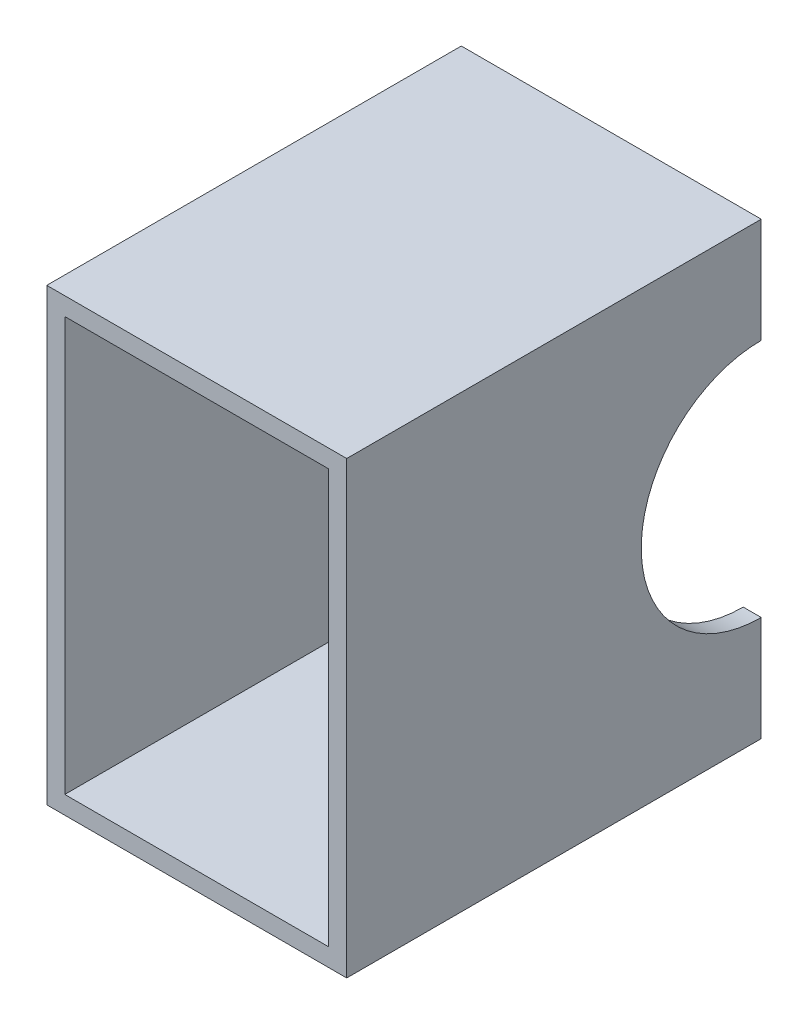
from build123d import *

# Parameters (mm, degrees)
SKETCH1_W               = 100
SKETCH1_H               = 150
SKETCH1_W_2             = 88
SKETCH1_H_2             = 138
BOSS_EXTRUDE1_DEPTH     = 138.202315188
CUT_EXTRUDE1_DEPTH      = 165.999636131
CUT_EXTRUDE1_DEPTH_BACK = 165.999636131
SKETCH2_R               = 40


with BuildPart() as part:
    # Sketch1 → Boss-Extrude1 (new body)
    with BuildSketch(Plane.XY):
        Rectangle(SKETCH1_W, SKETCH1_H)
        Rectangle(SKETCH1_W_2, SKETCH1_H_2, mode=Mode.SUBTRACT)
    extrude(amount=BOSS_EXTRUDE1_DEPTH)

    # Sketch2 → Cut-Extrude1 (cut, two sides: drawn at the far end of the back side and taken through both)
    with BuildSketch(Plane(origin=(0, 0, 0), x_dir=(0, 0, -1), z_dir=(1, 0, 0)).offset(-CUT_EXTRUDE1_DEPTH_BACK)):
        Circle(SKETCH2_R)
    extrude(amount=CUT_EXTRUDE1_DEPTH + CUT_EXTRUDE1_DEPTH_BACK, mode=Mode.SUBTRACT)


solid = part.part
